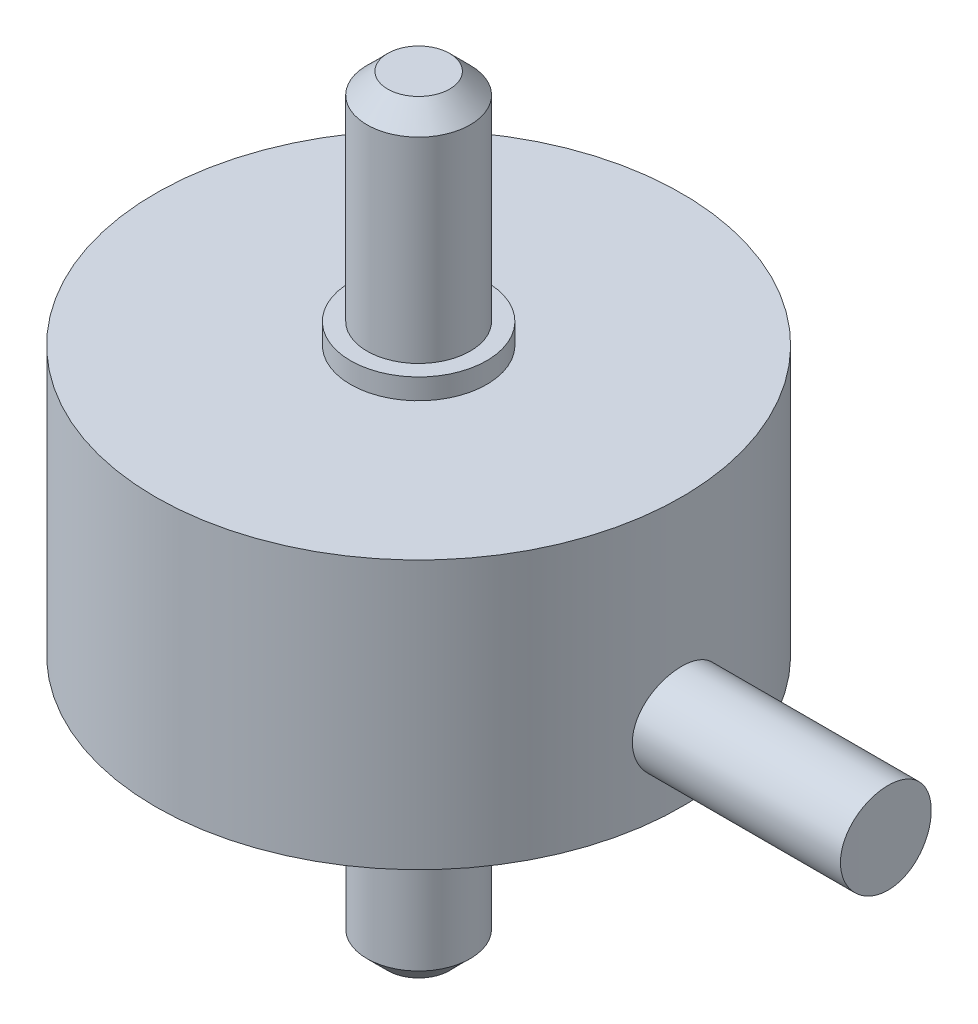
from build123d import *

# Parameters (mm, degrees)
SKETCH1_R                = 12.75
BOSS_EXTRUDE1_DEPTH      = 13
SKETCH2_R                = 3.3
BOSS_EXTRUDE2_DEPTH      = 1
SKETCH3_R                = 2.5
BOSS_EXTRUDE3_DEPTH      = 10.5
SKETCH4_R                = 5
BOSS_EXTRUDE4_DEPTH      = 2
BOSS_EXTRUDE5_START      = 10.5
SKETCH5_R                = 2.5
BOSS_EXTRUDE5_DEPTH      = 10.5
CHAMFER1_SIZE            = 1
BOSS_EXTRUDE6_REACH      = 32.42
BOSS_EXTRUDE6_END_RADIUS = 22.75
SKETCH6_R                = 2.2


with BuildPart() as part:
    # Sketch1 → Boss-Extrude1 (new body)
    with BuildSketch(Plane(origin=(0, 0, 0), x_dir=(1, 0, 0), z_dir=(0, 1, 0))):
        with Locations(Location((0, 0, 0), (0, 0, 90))):
            Circle(SKETCH1_R)
    extrude(amount=BOSS_EXTRUDE1_DEPTH)

    # Sketch2 → Boss-Extrude2 (add)
    with BuildSketch(Plane(origin=(0, 13, 0), x_dir=(1, 0, 0), z_dir=(0, 1, 0))):
        with Locations(Location((0, 0, 0), (0, 0, 270))):
            Circle(SKETCH2_R)
    extrude(amount=BOSS_EXTRUDE2_DEPTH)

    # Sketch3 → Boss-Extrude3 (add)
    with BuildSketch(Plane(origin=(0, 14, 0), x_dir=(1, 0, 0), z_dir=(0, 1, 0))):
        with Locations(Location((0, 0, 0), (0, 0, 90))):
            Circle(SKETCH3_R)
    extrude(amount=BOSS_EXTRUDE3_DEPTH)

    # Sketch4 → Boss-Extrude4 (add)
    with BuildSketch(Plane.XZ):
        with Locations(Location((0, 0, 0), (0, 0, 270))):
            Circle(SKETCH4_R)
    extrude(amount=BOSS_EXTRUDE4_DEPTH)

    # Sketch5 → Boss-Extrude5 (add)
    with BuildSketch(Plane.XZ.offset(2).offset(BOSS_EXTRUDE5_START)):
        with Locations(Location((0, 0, 0), (0, 0, 270))):
            Circle(SKETCH5_R)
    extrude(amount=-BOSS_EXTRUDE5_DEPTH)

    # Chamfer1
    chamfer1_edges = [part.edges().sort_by_distance(p)[0] for p in [
        (0, 24.5, 2.5),
        (0, -12.5, 2.5),
    ]]
    chamfer(chamfer1_edges, length=CHAMFER1_SIZE)

    # Boss-Extrude6: up to this cylinder (the profile starts inside it)
    boss_extrude6_end = Plane(origin=(0, 3.7, 0), z_dir=(0, -1, 0)) * Cylinder(BOSS_EXTRUDE6_END_RADIUS, 111.34, mode=Mode.PRIVATE)
    # Sketch6 → Boss-Extrude6 (add, up to the surface)
    with BuildSketch(Plane(origin=(0, 0, 0), x_dir=(0, 0, -1), z_dir=(1, 0, 0)), mode=Mode.PRIVATE) as boss_extrude6_sk1:
        with Locations(Location((0, 3.7, 0), (0, 0, 180))):
            Circle(SKETCH6_R)
    boss_extrude6_tool1 = extrude(boss_extrude6_sk1.sketch, amount=BOSS_EXTRUDE6_REACH, mode=Mode.PRIVATE) & boss_extrude6_end
    add(boss_extrude6_tool1.solids().sort_by_distance((0, 3.7, 0))[0])


solid = part.part
